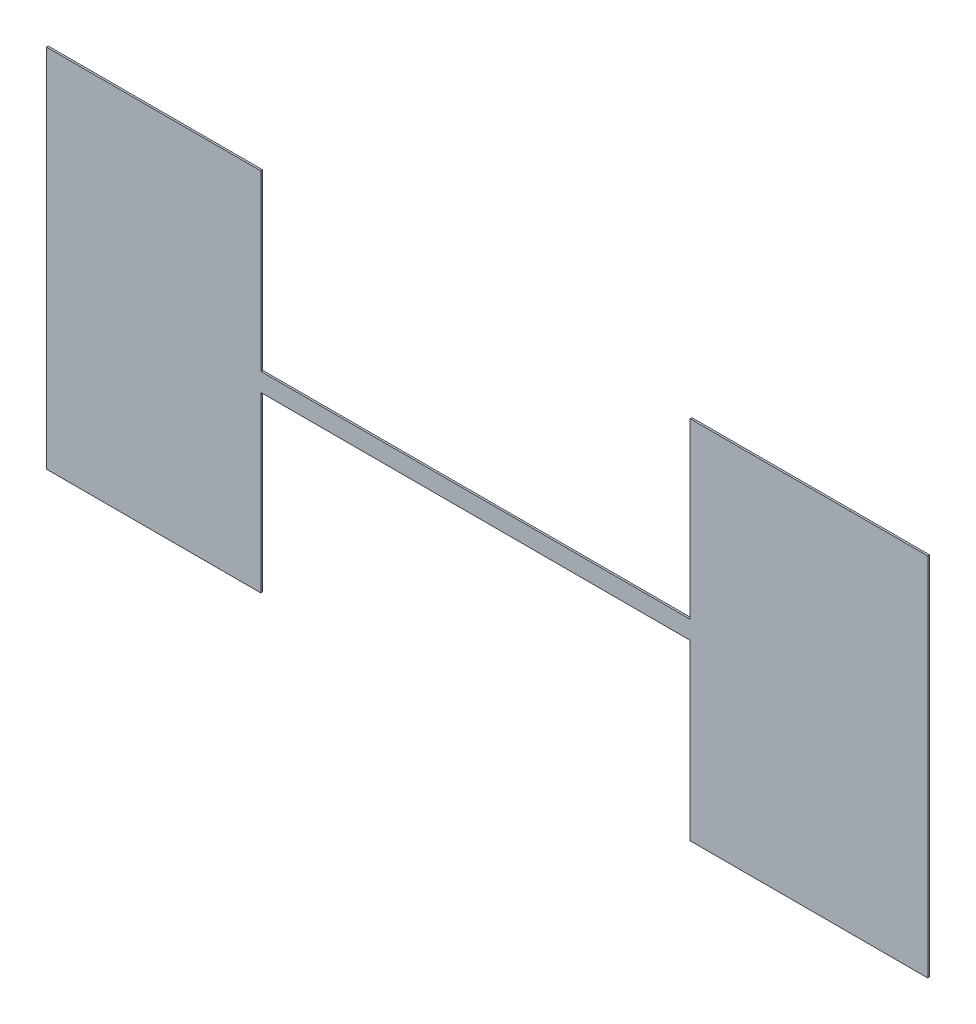
from build123d import *

# Parameters (mm, degrees)
BOSS_EXTRUDE1_DEPTH = 10


with BuildPart() as part:
    # Sketch1 → Boss-Extrude1 (new body)
    with BuildSketch(Plane.XY):
        Polygon((-650, 1000), (523, 1000), (523, 50), (2872.5, 50), (2872.5, 1000), (4172.5, 1000), (4172.5, -1000), (2872.5, -1000), (2872.5, -50), (523, -50), (523, -1000), (-650, -1000), align=None)
    extrude(amount=BOSS_EXTRUDE1_DEPTH)


solid = part.part
